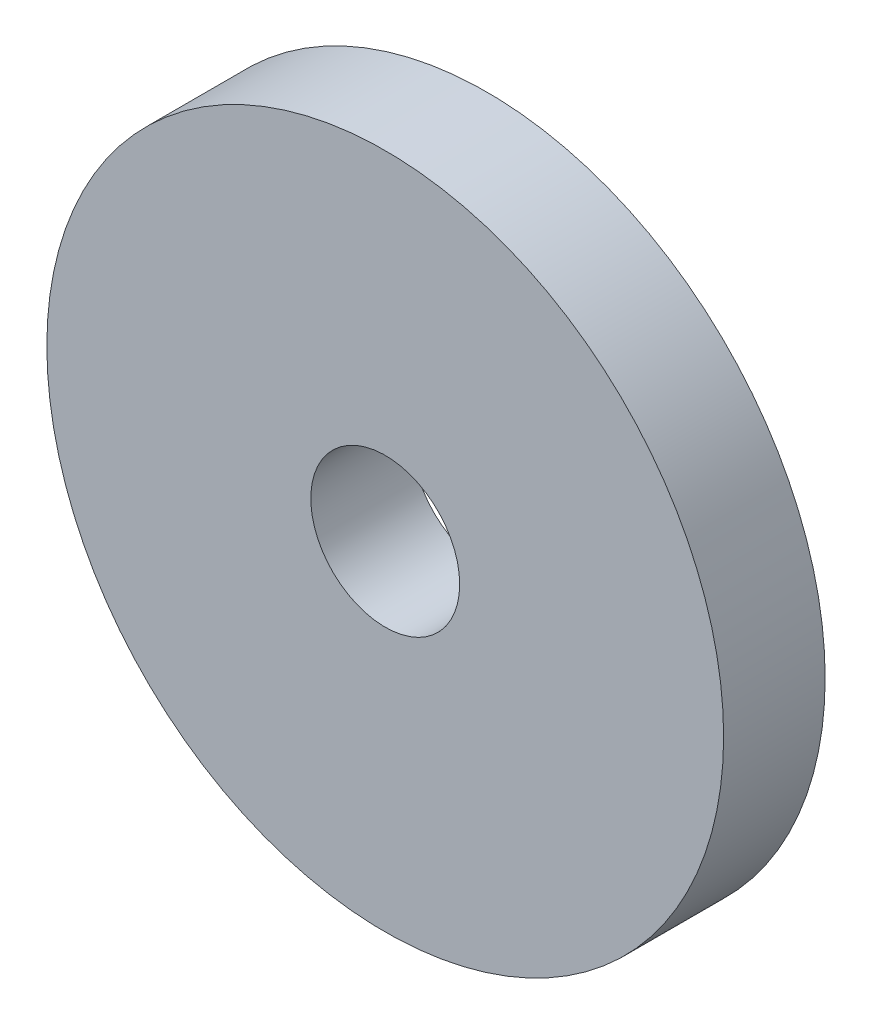
from build123d import *

# Parameters (mm, degrees)
SKETCH_1_R      = 5
SKETCH_1_R_2    = 1.1
EXTRUDE_1_DEPTH = 1.5


with BuildPart() as part:
    # 草图1 → 凸台-拉伸1 (new body)
    with BuildSketch(Plane.XY):
        Circle(SKETCH_1_R)
        Circle(SKETCH_1_R_2, mode=Mode.SUBTRACT)
    extrude(amount=EXTRUDE_1_DEPTH)


solid = part.part
